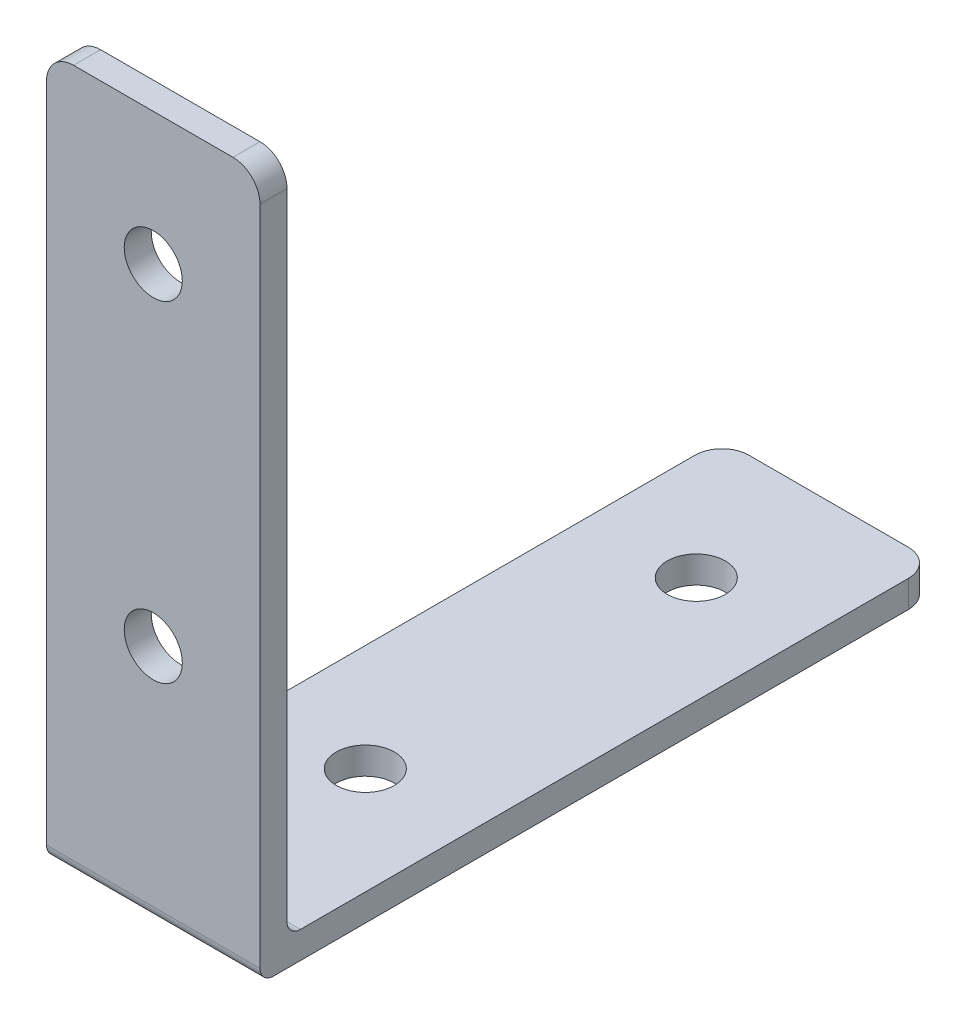
from build123d import *

# Parameters (mm, degrees)
SKETCH_1_W          = 15.8
SKETCH_1_H          = 2
EXTRUDE_1_DEPTH     = 50
SKETCH_2_W          = 15.8
SKETCH_2_H          = 2
EXTRUDE_2_DEPTH     = 50
FILLET_5_R          = 1
FILLET_6_R          = 1
FILLET_7_R          = 2
FILLET_8_R          = 2
SKETCH_3_R          = 2.15
CUT_EXTRUDE_1_DEPTH = 50
SKETCH_8_R          = 2.15
CUT_EXTRUDE_3_DEPTH = 50


with BuildPart() as part:
    # 草圖1 → 填料-伸長1 (new body)
    with BuildSketch(Plane.XY):
        Rectangle(SKETCH_1_W, SKETCH_1_H)
    extrude(amount=EXTRUDE_1_DEPTH)

    # 草圖2 → 填料-伸長2 (add)
    with BuildSketch(Plane(origin=(0, 1, 0), x_dir=(1, 0, 0), z_dir=(0, 1, 0))):
        with Locations((0, -49)):
            Rectangle(SKETCH_2_W, SKETCH_2_H)
    extrude(amount=EXTRUDE_2_DEPTH)

    # 圓角5
    fillet_5_edges = [part.edges().sort_by_distance(p)[0] for p in [
        (0, -1, 50),
    ]]
    fillet(fillet_5_edges, radius=FILLET_5_R)

    # 圓角6
    fillet_6_edges = [part.edges().sort_by_distance(p)[0] for p in [
        (0, 1, 48),
    ]]
    fillet(fillet_6_edges, radius=FILLET_6_R)

    # 圓角7
    fillet_7_edges = [part.edges().sort_by_distance(p)[0] for p in [
        (7.9, 51, 49),
    ]]
    fillet(fillet_7_edges, radius=FILLET_7_R)

    # 圓角8
    fillet_8_edges = [part.edges().sort_by_distance(p)[0] for p in [
        (-7.9, 51, 49),
        (7.9, 0, 0),
        (-7.9, 0, 0),
    ]]
    fillet(fillet_8_edges, radius=FILLET_8_R)

    # 草圖3 → 除料-伸長1 (cut)
    with BuildSketch(Plane(origin=(0, 0, 48), x_dir=(-1, 0, 0), z_dir=(0, 0, -1))):
        with Locations((0, 41.2)):
            Circle(SKETCH_3_R)
        with Locations((0, 16.7)):
            Circle(SKETCH_3_R)
    extrude(amount=-CUT_EXTRUDE_1_DEPTH, mode=Mode.SUBTRACT)

    # 草圖8 → 除料-伸長3 (cut)
    with BuildSketch(Plane(origin=(0, 1, 0), x_dir=(1, 0, 0), z_dir=(0, 1, 0))):
        with Locations(Location((0, -9.8, 0), (0, 0, 180))):
            Circle(SKETCH_8_R)
        with Locations(Location((0, -34.3, 0), (0, 0, 180))):
            Circle(SKETCH_8_R)
    extrude(amount=-CUT_EXTRUDE_3_DEPTH, mode=Mode.SUBTRACT)


solid = part.part
